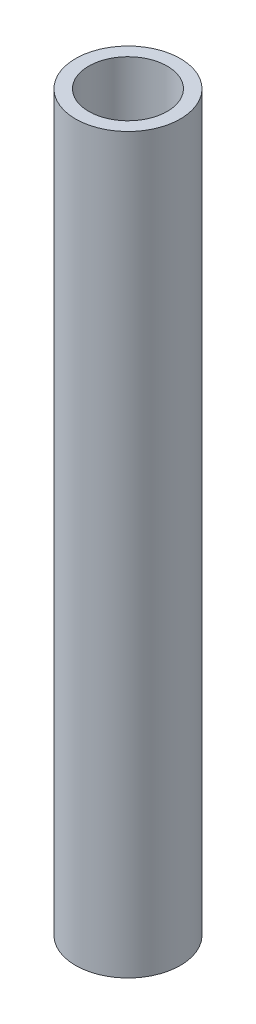
from build123d import *

# Parameters (mm, degrees)
SKETCH1_R           = 12.7
SKETCH1_R_2         = 9.525
BOSS_EXTRUDE1_DEPTH = 177.8


with BuildPart() as part:
    # Sketch1 → Boss-Extrude1 (new body)
    with BuildSketch(Plane(origin=(0, 0, 0), x_dir=(1, 0, 0), z_dir=(0, 1, 0))):
        with Locations(Location((0, 0, 0), (0, 0, 270))):
            Circle(SKETCH1_R)
        with Locations(Location((0, 0, 0), (0, 0, 270))):
            Circle(SKETCH1_R_2, mode=Mode.SUBTRACT)
    extrude(amount=BOSS_EXTRUDE1_DEPTH)


solid = part.part
